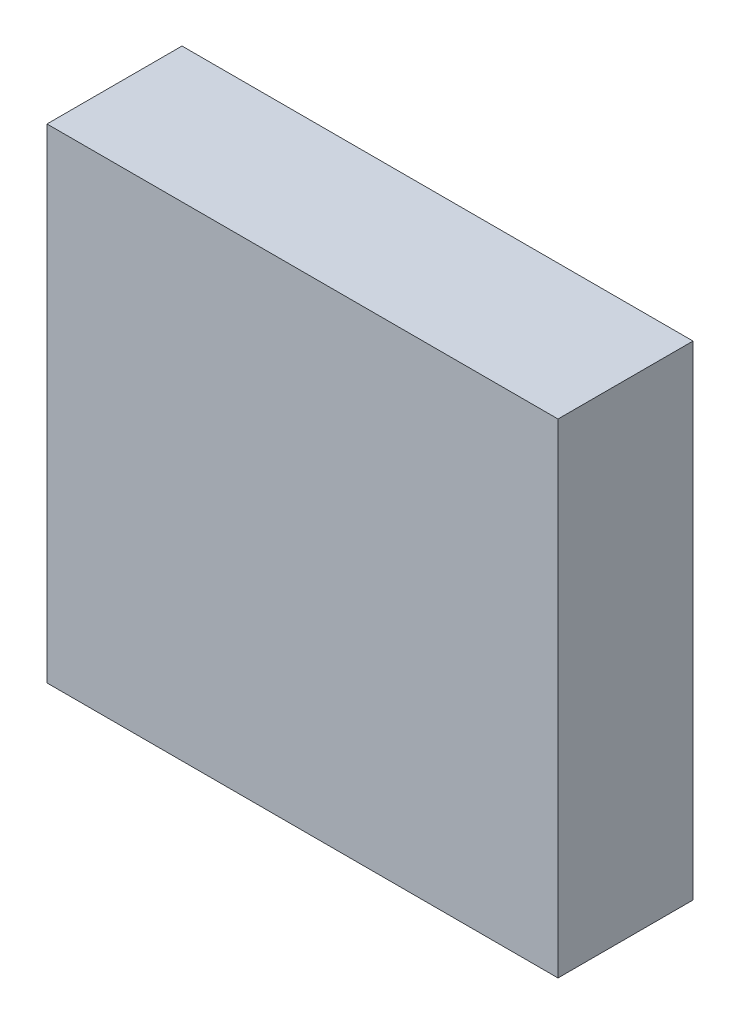
from build123d import *

# Parameters (mm, degrees)
SKETCH1_W                 = 95
SKETCH1_H                 = 90
BOSS_EXTRUDE1_DEPTH       = 25.1
SHELL1_T                  = -7.82
SHELL1_THICKNESS_2_FACE_W = 79.36
SHELL1_THICKNESS_2_FACE_H = 74.36
SHELL1_THICKNESS_2_DEPTH  = 2.97


with BuildPart() as part:
    # Sketch1 → Boss-Extrude1 (new body)
    with BuildSketch(Plane.XY):
        Rectangle(SKETCH1_W, SKETCH1_H)
    extrude(amount=BOSS_EXTRUDE1_DEPTH)

    # Shell1
    shell1_openings = [part.faces().sort_by_distance(p)[0] for p in [
        (0, 0, 0),
    ]]
    offset(amount=SHELL1_T, openings=shell1_openings, kind=Kind.INTERSECTION)

    # Shell1 thickness 2 face (on inner face of the shell) → Shell1 thickness 2 (add)
    with BuildSketch(Plane.XY.offset(17.28)):
        Rectangle(SHELL1_THICKNESS_2_FACE_W, SHELL1_THICKNESS_2_FACE_H)
    extrude(amount=-SHELL1_THICKNESS_2_DEPTH)


solid = part.part
